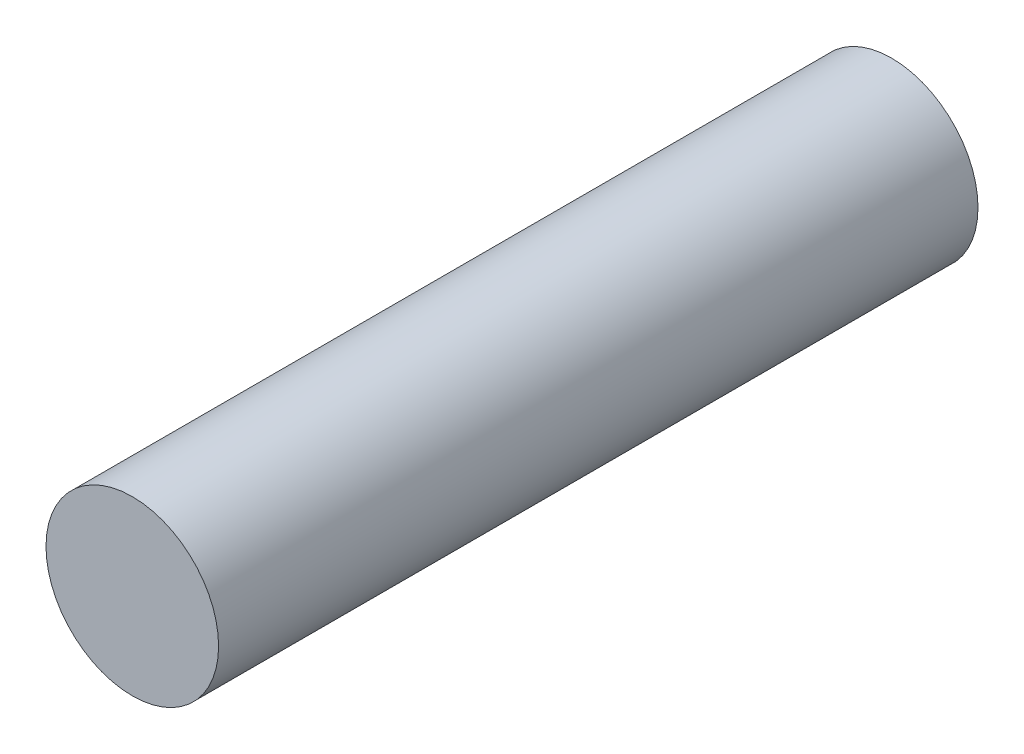
from build123d import *

# Parameters (mm, degrees)
SKETCH1_R           = 2.5
BOSS_EXTRUDE2_DEPTH = 22


with BuildPart() as part:
    # Sketch1 → Boss-Extrude2 (new body)
    with BuildSketch(Plane.XY):
        Circle(SKETCH1_R)
    extrude(amount=BOSS_EXTRUDE2_DEPTH)


solid = part.part
